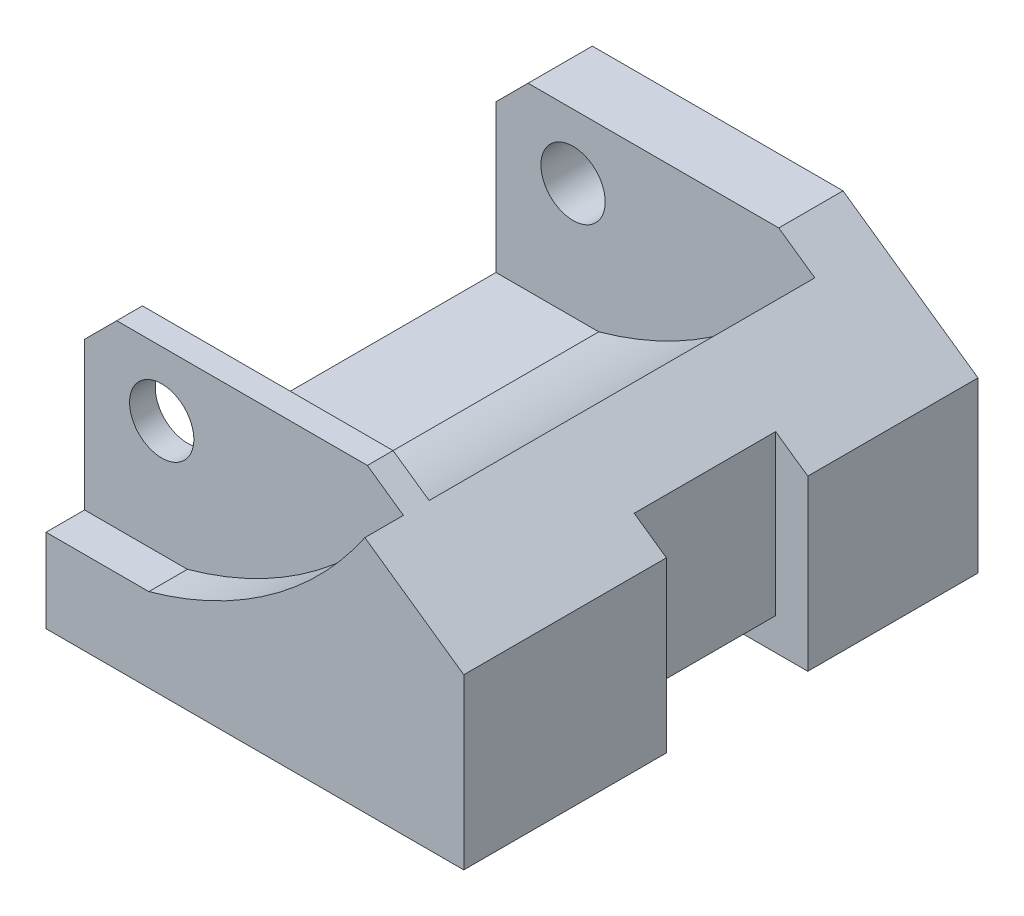
from build123d import *

# Parameters (mm, degrees)
SKETCH1_R            = 5
BOSS_EXTRUDE9_DEPTH  = 40
SKETCH6_W            = 49.606003438
SKETCH6_H            = 60
SKETCH6_H_2          = 6
CUT_EXTRUDE5_DEPTH   = 40
BOSS_EXTRUDE11_DEPTH = 40
SKETCH7_W            = 22
SKETCH7_H            = 29.796679389
CUT_EXTRUDE6_DEPTH   = 80
BOSS_EXTRUDE12_DEPTH = 40


with BuildPart() as part:
    # Sketch1 → Boss-Extrude9 (new, symmetric)
    with BuildSketch(Plane.XY):
        with BuildLine():
            ThreePointArc((16, 13), (34.941864918, 22.051658235), (49.606003438, 37.074634133))
            Line((49.606003438, 37.074634133), (44, 41))
            Line((44, 41), (5, 41))
            Line((5, 41), (0, 36))
            Line((0, 36), (0, 13))
            Line((0, 13), (16, 13))
        make_face()
        with Locations((12, 31)):
            Circle(SKETCH1_R, mode=Mode.SUBTRACT)
    extrude(amount=BOSS_EXTRUDE9_DEPTH, both=True)

    # Sketch6 → Cut-Extrude5 (cut)
    with BuildSketch(Plane(origin=(0, 41, 0), x_dir=(1, 0, 0), z_dir=(0, 1, 0))):
        with Locations((24.803001719, 0)):
            Rectangle(SKETCH6_W, SKETCH6_H)
        with Locations((24.803001719, -37)):
            Rectangle(SKETCH6_W, SKETCH6_H_2)
    extrude(amount=-CUT_EXTRUDE5_DEPTH, mode=Mode.SUBTRACT)


with BuildPart() as cut_extrude5_piece_1:
    # of the separate pieces the step leaves, piece 1, a body of its own (cut_extrude5_pieces)
    add(part.part.solids().sort_by_distance((16, 13, -30))[0])



with BuildPart() as cut_extrude5_piece_2:
    # of the separate pieces the step leaves, piece 2, a body of its own (cut_extrude5_pieces)
    add(part.part.solids().sort_by_distance((16, 13, 34))[0])


with BuildPart() as body_3:
    # Sketch1<13> → Boss-Extrude11 (new, symmetric)
    with BuildSketch(Plane.XY):
        Polygon((65, 26.295641698), (60, 29.796679389), (60, 5), (0, 5), (0, 0), (65, 0), align=None)
    extrude(amount=BOSS_EXTRUDE11_DEPTH, both=True)

    # Sketch7 → Cut-Extrude6 (cut)
    with BuildSketch(Plane(origin=(65, 0, 0), x_dir=(0, 0, -1), z_dir=(1, 0, 0))):
        with Locations((2.518815971, 14.898339695)):
            Rectangle(SKETCH7_W, SKETCH7_H)
    extrude(amount=-CUT_EXTRUDE6_DEPTH, mode=Mode.SUBTRACT)


with BuildPart() as cut_extrude6_piece_1:
    # of the separate pieces the step leaves, piece 1, a body of its own (cut_extrude6_pieces)
    add(body_3.part.solids().sort_by_distance((65, 26.295641698, 40))[0])


with BuildPart() as cut_extrude6_piece_2:
    # of the separate pieces the step leaves, piece 2, a body of its own (cut_extrude6_pieces)
    add(body_3.part.solids().sort_by_distance((65, 26.295641698, -13.518815971))[0])


with BuildPart() as cut_extrude5_piece_1_1:
    add(cut_extrude5_piece_1.part)

    add(cut_extrude5_piece_2.part)  # Boss-Extrude12 merges Cut-Extrude5 piece 2

    add(cut_extrude6_piece_1.part)  # Boss-Extrude12 merges Cut-Extrude6 piece 1

    add(cut_extrude6_piece_2.part)  # Boss-Extrude12 merges Cut-Extrude6 piece 2
    # Sketch1<14> → Boss-Extrude12 (add, symmetric)
    with BuildSketch(Plane.XY):
        with BuildLine():
            Line((60, 5), (60, 29.796679389))
            Line((60, 29.796679389), (49.606003438, 37.074634133))
            ThreePointArc((49.606003438, 37.074634133), (34.941864918, 22.051658235), (16, 13))
            Line((16, 13), (0, 13))
            Line((0, 13), (0, 5))
            Line((0, 5), (60, 5))
        make_face()
    extrude(amount=BOSS_EXTRUDE12_DEPTH, both=True)


solid = cut_extrude5_piece_1_1.part
